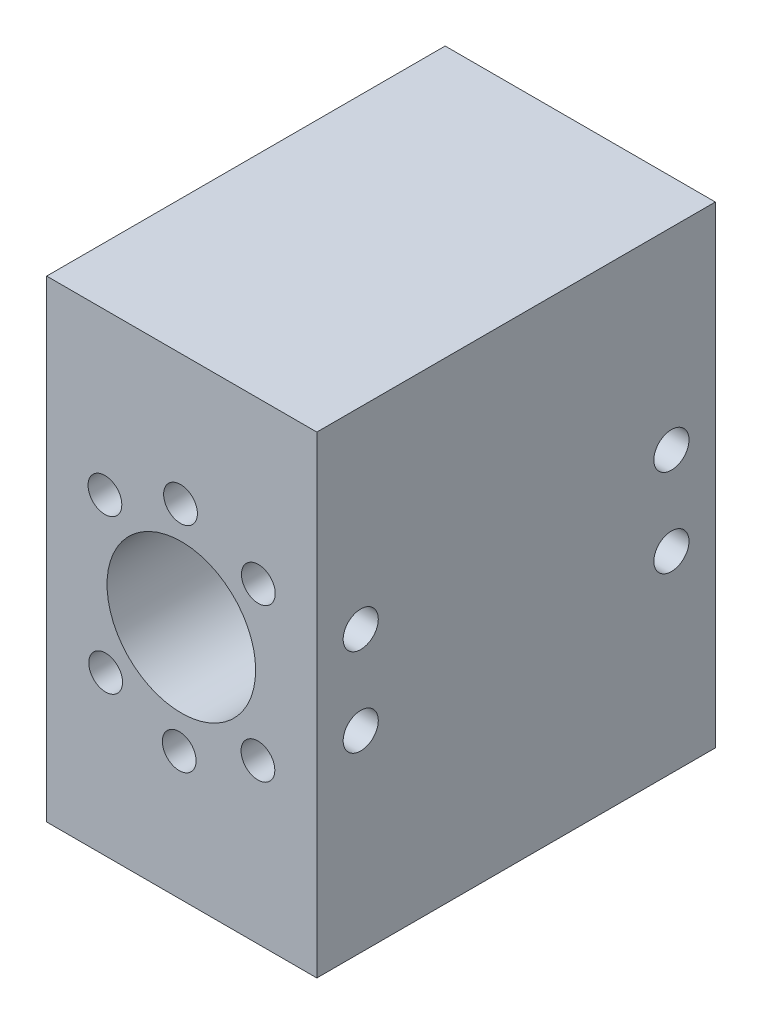
from build123d import *

# Parameters (mm, degrees)
SKETCH1_W                        = 40
SKETCH1_H                        = 70
BOSS_EXTRUDE1_DEPTH              = 59
SKETCH2_R                        = 11
SKETCH2_R_2                      = 2.5
CUT_EXTRUDE1_DEPTH               = 72.504101247
SKETCH5_R                        = 2.5
CUT_EXTRUDE3_DEPTH               = 5
TAP_DRILL_FOR_M5_HELICOIL1_D     = 5.2
TAP_DRILL_FOR_M5_HELICOIL1_DEPTH = 6.437762391
TAP_DRILL_FOR_M5_HELICOIL1_TIP   = 1.562237609


with BuildPart() as part:
    # Sketch1 → Boss-Extrude1 (new body)
    with BuildSketch(Plane.XY):
        with Locations((0.060830656, 0.062794648)):
            Rectangle(SKETCH1_W, SKETCH1_H)
    extrude(amount=BOSS_EXTRUDE1_DEPTH)

    # Sketch2 → Cut-Extrude1 (cut, through all)
    with BuildSketch(Plane.XY):
        Circle(SKETCH2_R)
        with Locations((-11.313708499, 11.313708499)):
            Circle(SKETCH2_R_2)
        with Locations((-0.122338904, 15.759725587)):
            Circle(SKETCH2_R_2)
        with Locations((11.402693442, 11.263696484)):
            Circle(SKETCH2_R_2)
        with Locations((11.339369089, -11.406422087)):
            Circle(SKETCH2_R_2)
        with Locations((-0.312311964, -16.029099896)):
            Circle(SKETCH2_R_2)
        with Locations((-11.204100775, -11.406422087)):
            Circle(SKETCH2_R_2)
    extrude(amount=CUT_EXTRUDE1_DEPTH, mode=Mode.SUBTRACT)

    # Sketch5 → Cut-Extrude3 (cut)
    with BuildSketch(Plane.ZY.offset(19.939169344)):
        with Locations((29.5, 0.062794648)):
            Circle(SKETCH5_R)
        with Locations((39.5, 0.062794648)):
            Circle(SKETCH5_R)
        with Locations((19.5, 0.062794648)):
            Circle(SKETCH5_R)
        with Locations((29.5, 10.062794648)):
            Circle(SKETCH5_R)
        with Locations((29.5, -9.937205352)):
            Circle(SKETCH5_R)
    extrude(amount=-CUT_EXTRUDE3_DEPTH, mode=Mode.SUBTRACT)

    # Tap Drill for M5 Helicoil1
    with Locations(Plane(origin=(20.060830656, 0, 0), x_dir=(0, 0, -1), z_dir=(1, 0, 0))):
        with Locations((-52.500633733, 6.530017119), (-52.500633733, -6.469982881), (-6.500633733, -6.469982881), (-6.500633733, 6.530017119)):
            Hole(TAP_DRILL_FOR_M5_HELICOIL1_D / 2, depth=TAP_DRILL_FOR_M5_HELICOIL1_DEPTH)
            with Locations((0, 0, -(TAP_DRILL_FOR_M5_HELICOIL1_DEPTH + TAP_DRILL_FOR_M5_HELICOIL1_TIP / 2))):  # 118° drill point
                Cone(0, TAP_DRILL_FOR_M5_HELICOIL1_D / 2, TAP_DRILL_FOR_M5_HELICOIL1_TIP, mode=Mode.SUBTRACT)


solid = part.part
